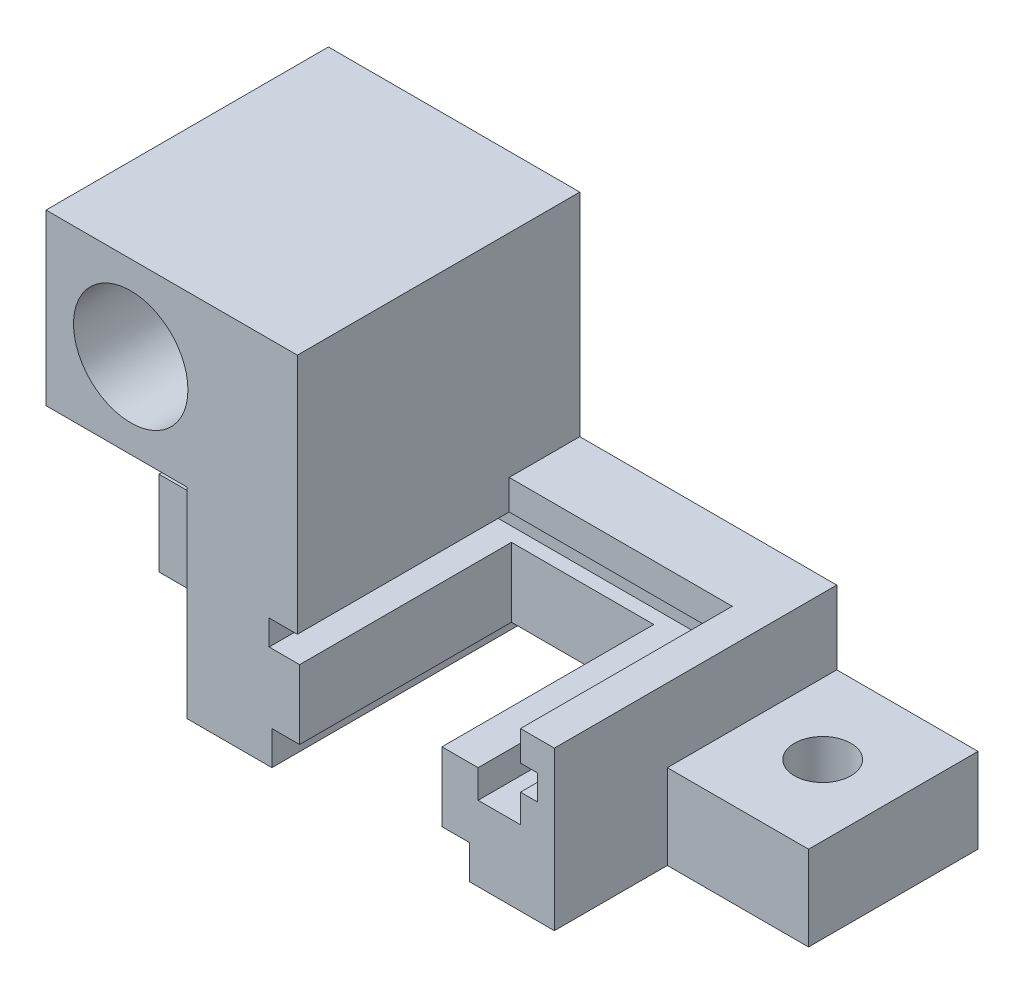
from build123d import *

# Parameters (mm, degrees)
SKETCH2_W           = 26
SKETCH2_H           = 11.2
BOSS_EXTRUDE1_DEPTH = 20
SKETCH6_W           = 14
SKETCH6_H           = 2.4
CUT_EXTRUDE1_DEPTH  = 20
SKETCH7_W           = 10.08
SKETCH7_H           = 4.9
CUT_EXTRUDE2_DEPTH  = 15
SKETCH8_W           = 19
SKETCH8_H           = 1.78
CUT_EXTRUDE3_DEPTH  = 16
SKETCH9_W           = 15.8
SKETCH9_H           = 2.12
CUT_EXTRUDE4_DEPTH  = 15
SKETCH10_W          = 3
SKETCH10_H          = 2
CUT_EXTRUDE5_DEPTH  = 15
CUT_REVOLVE3_ANGLE  = 180
SKETCH15_W          = 12
SKETCH15_H          = 6
BOSS_EXTRUDE2_DEPTH = 10
SKETCH16_W          = 12
SKETCH16_H          = 6
BOSS_EXTRUDE3_DEPTH = 10
SKETCH17_R          = 2
CUT_EXTRUDE6_DEPTH  = 12
SKETCH18_R          = 2
CUT_EXTRUDE7_DEPTH  = 12
SKETCH19_W          = 7.8
SKETCH19_H          = 20
BOSS_EXTRUDE4_DEPTH = 15
SKETCH20_W          = 20
SKETCH20_H          = 12
BOSS_EXTRUDE5_DEPTH = 10
SKETCH21_R          = 4.05
CUT_EXTRUDE8_DEPTH  = 18
SKETCH22_R          = 1.5
CUT_EXTRUDE9_DEPTH  = 5


with BuildPart() as part:
    # Sketch2 → Boss-Extrude1 (new body)
    with BuildSketch(Plane.XY):
        Rectangle(SKETCH2_W, SKETCH2_H)
    extrude(amount=BOSS_EXTRUDE1_DEPTH)

    # Sketch6 → Cut-Extrude1 (cut)
    with BuildSketch(Plane.XY.offset(20)):
        with Locations((0, -4.4)):
            Rectangle(SKETCH6_W, SKETCH6_H)
    extrude(amount=-CUT_EXTRUDE1_DEPTH, mode=Mode.SUBTRACT)

    # Sketch7 → Cut-Extrude2 (cut)
    with BuildSketch(Plane.XY.offset(20)):
        with Locations((0, -0.75)):
            Rectangle(SKETCH7_W, SKETCH7_H)
    extrude(amount=-CUT_EXTRUDE2_DEPTH, mode=Mode.SUBTRACT)

    # Sketch8 → Cut-Extrude3 (cut)
    with BuildSketch(Plane.XY.offset(20)):
        with Locations((2.3, 2.59)):
            Rectangle(SKETCH8_W, SKETCH8_H)
    extrude(amount=-CUT_EXTRUDE3_DEPTH, mode=Mode.SUBTRACT)

    # Sketch9 → Cut-Extrude4 (cut)
    with BuildSketch(Plane.XY.offset(20)):
        with Locations((2.7, 4.54)):
            Rectangle(SKETCH9_W, SKETCH9_H)
    extrude(amount=-CUT_EXTRUDE4_DEPTH, mode=Mode.SUBTRACT)

    # Sketch10 → Cut-Extrude5 (cut)
    with BuildSketch(Plane.XY.offset(20)):
        with Locations((9.1, 0.7)):
            Rectangle(SKETCH10_W, SKETCH10_H)
    extrude(amount=-CUT_EXTRUDE5_DEPTH, mode=Mode.SUBTRACT)

    # Sketch11 → Cut-Revolve3 (revolve, cut)
    with BuildSketch(Plane.XZ.offset(5.6)):
        with BuildLine():
            Line((-11.55, 5), (-8.45, 5))
            ThreePointArc((-8.45, 5), (-10, 6.55), (-11.55, 5))
        make_face()
    revolve(axis=Axis((-11.55, -5.6, 5), (-1, 0, 0)), revolution_arc=CUT_REVOLVE3_ANGLE, mode=Mode.SUBTRACT)

    # Sketch12 → Revolve2 (revolve)
    with BuildSketch(Plane.XZ.offset(5.6)):
        with BuildLine():
            Line((-11.5, 15), (-8.5, 15))
            ThreePointArc((-8.5, 15), (-10, 13.5), (-11.5, 15))
        make_face()
    revolve(axis=Axis((-11.5, -5.6, 15), (1, 0, 0)))

    # Sketch14 → Cut-Revolve4 (revolve, cut)
    with BuildSketch(Plane.XZ.offset(5.6)):
        with BuildLine():
            Line((8.45, 15), (11.55, 15))
            ThreePointArc((11.55, 15), (10, 13.45), (8.45, 15))
        make_face()
    revolve(axis=Axis((8.45, -5.6, 15), (1, 0, 0)), mode=Mode.SUBTRACT)

    # Sketch13 → Revolve3 (revolve)
    with BuildSketch(Plane.XZ.offset(5.6)):
        with BuildLine():
            Line((8.5, 5), (11.5, 5))
            ThreePointArc((11.5, 5), (10, 6.5), (8.5, 5))
        make_face()
    revolve(axis=Axis((8.5, -5.6, 5), (1, 0, 0)))

    # Sketch15 → Boss-Extrude2 (add)
    with BuildSketch(Plane.ZY.offset(13)):
        with Locations((6, -2.6)):
            Rectangle(SKETCH15_W, SKETCH15_H)
    extrude(amount=BOSS_EXTRUDE2_DEPTH)

    # Sketch16 → Boss-Extrude3 (add)
    with BuildSketch(Plane(origin=(13, 0, 0), x_dir=(0, 0, -1), z_dir=(1, 0, 0))):
        with Locations((-6, -2.6)):
            Rectangle(SKETCH16_W, SKETCH16_H)
    extrude(amount=BOSS_EXTRUDE3_DEPTH)

    # Sketch17 → Cut-Extrude6 (cut)
    with BuildSketch(Plane.XZ.offset(5.6)):
        with Locations(Location((-18, 6, 0), (0, 0, 270))):
            Circle(SKETCH17_R)
    extrude(amount=-CUT_EXTRUDE6_DEPTH, mode=Mode.SUBTRACT)

    # Sketch18 → Cut-Extrude7 (cut)
    with BuildSketch(Plane.XZ.offset(5.6)):
        with Locations(Location((18, 6, 0), (0, 0, 270))):
            Circle(SKETCH18_R)
    extrude(amount=-CUT_EXTRUDE7_DEPTH, mode=Mode.SUBTRACT)

    # Sketch19 → Boss-Extrude4 (add)
    with BuildSketch(Plane(origin=(0, 5.6, 0), x_dir=(1, 0, 0), z_dir=(0, 1, 0))):
        with Locations((-9.1, -10)):
            Rectangle(SKETCH19_W, SKETCH19_H)
    extrude(amount=BOSS_EXTRUDE4_DEPTH)

    # Sketch20 → Boss-Extrude5 (add)
    with BuildSketch(Plane.ZY.offset(13)):
        with Locations((10, 14.6)):
            Rectangle(SKETCH20_W, SKETCH20_H)
    extrude(amount=BOSS_EXTRUDE5_DEPTH)

    # Sketch21 → Cut-Extrude8 (cut)
    with BuildSketch(Plane.XY.offset(20)):
        with Locations((-17, 14.6)):
            Circle(SKETCH21_R)
    extrude(amount=-CUT_EXTRUDE8_DEPTH, mode=Mode.SUBTRACT)

    # Sketch22 → Cut-Extrude9 (cut)
    with BuildSketch(Plane.ZY.offset(23)):
        with Locations(Location((11, 14.6, 0), (0, 0, 270))):
            Circle(SKETCH22_R)
    extrude(amount=-CUT_EXTRUDE9_DEPTH, mode=Mode.SUBTRACT)


solid = part.part
